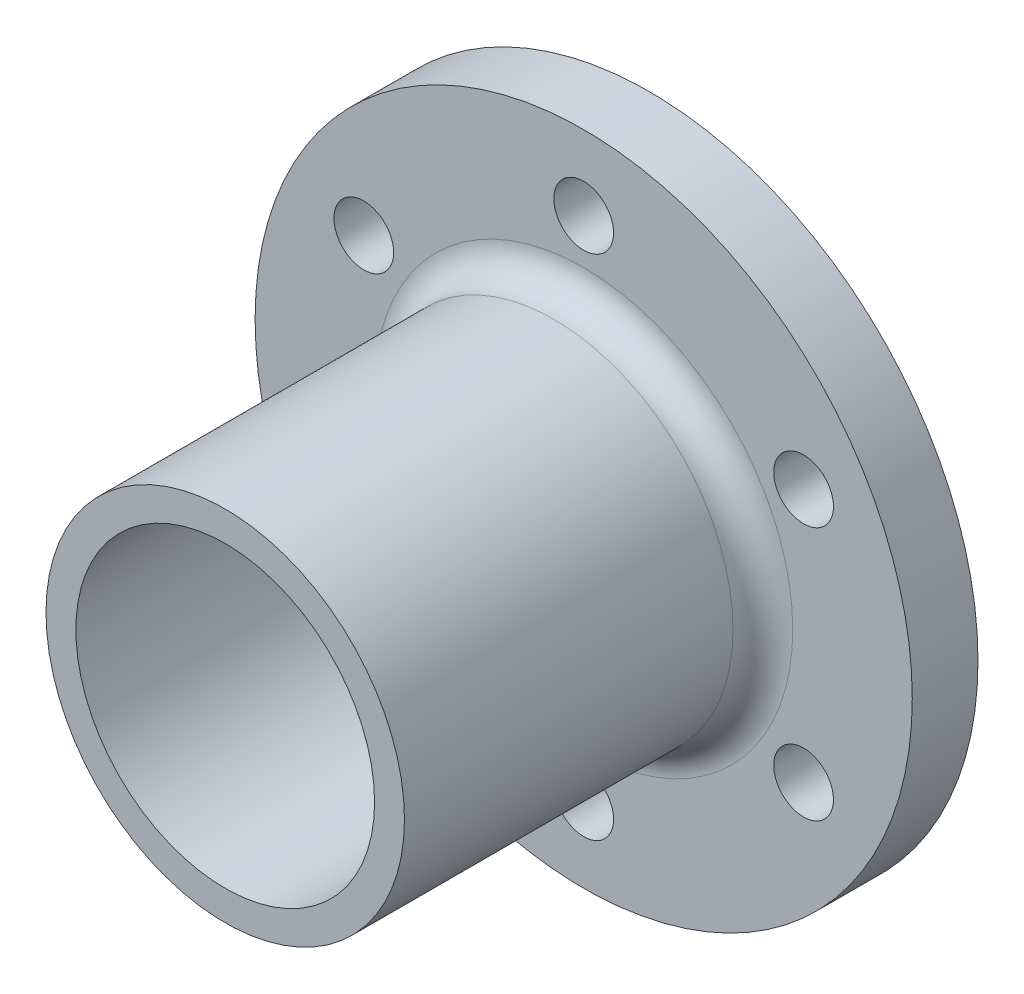
from build123d import *

# Parameters (mm, degrees)
SKETCH1_R           = 110
BOSS_EXTRUDE1_DEPTH = 22
SKETCH2_R           = 60
BOSS_EXTRUDE2_DEPTH = 120
SKETCH3_R           = 50
CUT_EXTRUDE1_DEPTH  = 211.627633515
SKETCH4_R           = 10
CUT_EXTRUDE2_DEPTH  = 197.468827044
FILLET1_R           = 10


with BuildPart() as part:
    # Sketch1 → Boss-Extrude1 (new body)
    with BuildSketch(Plane.XY):
        Circle(SKETCH1_R)
    extrude(amount=BOSS_EXTRUDE1_DEPTH)

    # Sketch2 → Boss-Extrude2 (add)
    with BuildSketch(Plane.XY.offset(22)):
        Circle(SKETCH2_R)
    extrude(amount=BOSS_EXTRUDE2_DEPTH)

    # Sketch3 → Cut-Extrude1 (cut, through all)
    with BuildSketch(Plane.XY.offset(142)):
        Circle(SKETCH3_R)
    extrude(amount=-CUT_EXTRUDE1_DEPTH, mode=Mode.SUBTRACT)

    # Sketch4 → Cut-Extrude2 (cut, through all)
    with BuildSketch(Plane.XY.offset(22)):
        with Locations((0, 85)):
            Circle(SKETCH4_R)
        with Locations((73.612159322, 42.5)):
            Circle(SKETCH4_R)
        with Locations((73.612159322, -42.5)):
            Circle(SKETCH4_R)
        with Locations((0, -85)):
            Circle(SKETCH4_R)
        with Locations((-73.612159322, -42.5)):
            Circle(SKETCH4_R)
        with Locations((-73.612159322, 42.5)):
            Circle(SKETCH4_R)
    extrude(amount=-CUT_EXTRUDE2_DEPTH, mode=Mode.SUBTRACT)

    # Fillet1
    fillet1_edges = [part.edges().sort_by_distance(p)[0] for p in [
        (-60, 0, 22),
    ]]
    fillet(fillet1_edges, radius=FILLET1_R)


solid = part.part
